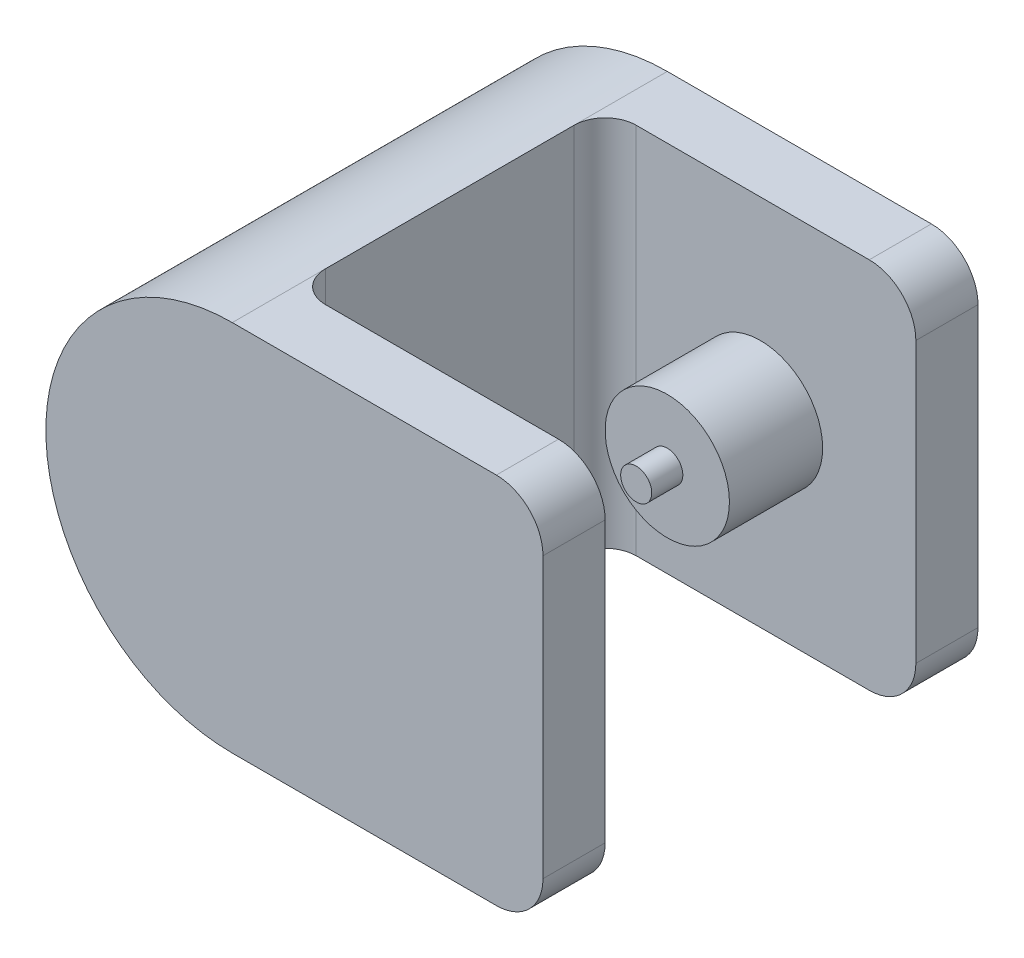
from build123d import *

# Parameters (mm, degrees)
IZIM1_W                     = 100
IZIM1_H                     = 120
Y_KSEKLIK_EKSTR_ZYON1_DEPTH = 20
Y_KSEKLIK_EKSTR_ZYON2_DEPTH = 120
Y_KSEKLIK_EKSTR_ZYON3_DEPTH = 20
RADYUS1_R                   = 10
RADYUS2_R                   = 15
IZIM3_R                     = 20
Y_KSEKLIK_EKSTR_ZYON4_DEPTH = 30
IZIM4_R                     = 5
Y_KSEKLIK_EKSTR_ZYON5_DEPTH = 10
Y_KSEKLIK_EKSTR_ZYON6_START = 30
IZIM5_R                     = 20
Y_KSEKLIK_EKSTR_ZYON6_DEPTH = 30
Y_KSEKLIK_EKSTR_ZYON7_START = 10
IZIM6_R                     = 5
Y_KSEKLIK_EKSTR_ZYON7_DEPTH = 10


with BuildPart() as part:
    # Çizim1 → Yükseklik-Ekstrüzyon1 (new body)
    with BuildSketch(Plane.XY):
        Rectangle(IZIM1_W, IZIM1_H)
    extrude(amount=Y_KSEKLIK_EKSTR_ZYON1_DEPTH)

    # Çizim1<3> → Yükseklik-Ekstrüzyon2 (add)
    with BuildSketch(Plane.XY):
        with BuildLine():
            ThreePointArc((-50, 60), (-110, 0), (-50, -60))
            Line((-50, -60), (-50, 60))
        make_face()
    extrude(amount=Y_KSEKLIK_EKSTR_ZYON2_DEPTH)

    # Çizim2 → Yükseklik-Ekstrüzyon3 (add)
    with BuildSketch(Plane.XY.offset(120)):
        with BuildLine():
            Line((-50, -60), (50, -60))
            Line((50, -60), (50, 60))
            Line((50, 60), (-50, 60))
            ThreePointArc((-50, 60), (-110, 0), (-50, -60))
        make_face()
    extrude(amount=Y_KSEKLIK_EKSTR_ZYON3_DEPTH)

    # Radyus1
    radyus1_edges = [part.edges().sort_by_distance(p)[0] for p in [
        (-50, 0, 20),
        (-50, 0, 120),
    ]]
    fillet(radyus1_edges, radius=RADYUS1_R)

    # Radyus2
    radyus2_edges = [part.edges().sort_by_distance(p)[0] for p in [
        (50, 60, 130),
        (50, -60, 130),
        (50, 60, 10),
        (50, -60, 10),
    ]]
    fillet(radyus2_edges, radius=RADYUS2_R)

    # Çizim3 → Yükseklik-Ekstrüzyon4 (add)
    with BuildSketch(Plane.XY.offset(20)):
        Circle(IZIM3_R)
    extrude(amount=Y_KSEKLIK_EKSTR_ZYON4_DEPTH)

    # Çizim4 → Yükseklik-Ekstrüzyon5 (add)
    with BuildSketch(Plane.XY.offset(50)):
        Circle(IZIM4_R)
    extrude(amount=Y_KSEKLIK_EKSTR_ZYON5_DEPTH)

    # Çizim5 → Yükseklik-Ekstrüzyon6 (add)
    with BuildSketch(Plane(origin=(0, 0, 120), x_dir=(1, 0, 0), z_dir=(0, 0, -1)).offset(Y_KSEKLIK_EKSTR_ZYON6_START)):
        Circle(IZIM5_R)
    extrude(amount=-Y_KSEKLIK_EKSTR_ZYON6_DEPTH)

    # Çizim6 → Yükseklik-Ekstrüzyon7 (add)
    with BuildSketch(Plane(origin=(0, 0, 90), x_dir=(1, 0, 0), z_dir=(0, 0, -1)).offset(Y_KSEKLIK_EKSTR_ZYON7_START)):
        Circle(IZIM6_R)
    extrude(amount=-Y_KSEKLIK_EKSTR_ZYON7_DEPTH)


solid = part.part
